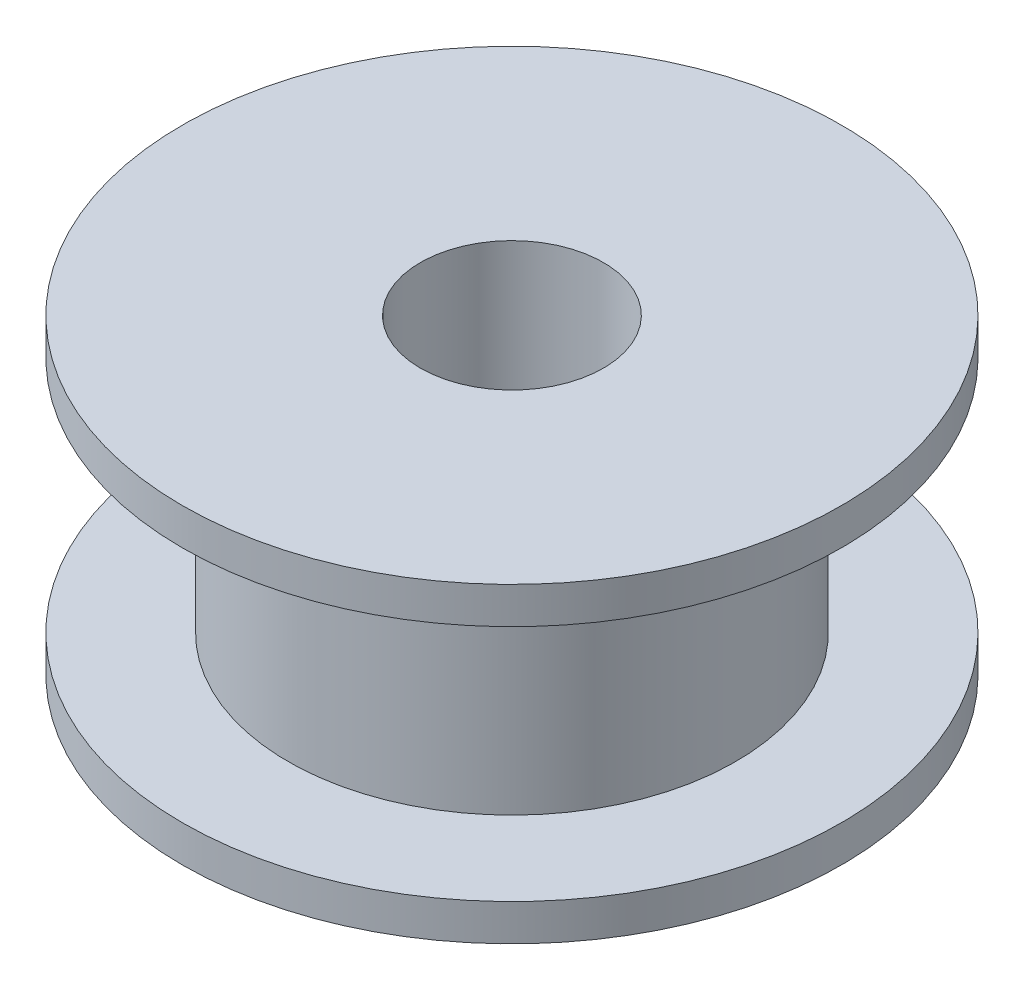
from build123d import *

# Parameters (mm, degrees)
SKETCH_1_R          = 9
EXTRUDE_1_DEPTH     = 1
SKETCH_2_R          = 6.11
EXTRUDE_2_DEPTH     = 6.5
SKETCH_3_R          = 9
EXTRUDE_3_DEPTH     = 1
SKETCH_4_R          = 2.5
CUT_EXTRUDE_1_DEPTH = 13


with BuildPart() as part:
    # 草图1 → 凸台-拉伸1 (new body)
    with BuildSketch(Plane(origin=(0, 0, 0), x_dir=(1, 0, 0), z_dir=(0, 1, 0))):
        with Locations(Location((0, 0, 0), (0, 0, 270))):
            Circle(SKETCH_1_R)
    extrude(amount=EXTRUDE_1_DEPTH)

    # 草图2 → 凸台-拉伸2 (add)
    with BuildSketch(Plane(origin=(0, 1, 0), x_dir=(1, 0, 0), z_dir=(0, 1, 0))):
        with Locations(Location((0, 0, 0), (0, 0, 90))):
            Circle(SKETCH_2_R)
    extrude(amount=EXTRUDE_2_DEPTH)

    # 草图3 → 凸台-拉伸3 (add)
    with BuildSketch(Plane(origin=(0, 7.5, 0), x_dir=(1, 0, 0), z_dir=(0, 1, 0))):
        with Locations(Location((0, 0, 0), (0, 0, 270))):
            Circle(SKETCH_3_R)
    extrude(amount=EXTRUDE_3_DEPTH)

    # 草图4 → 切除-拉伸1 (cut)
    with BuildSketch(Plane(origin=(0, 8.5, 0), x_dir=(1, 0, 0), z_dir=(0, 1, 0))):
        with Locations(Location((0, 0, 0), (0, 0, 270))):
            Circle(SKETCH_4_R)
    extrude(amount=-CUT_EXTRUDE_1_DEPTH, mode=Mode.SUBTRACT)


solid = part.part
